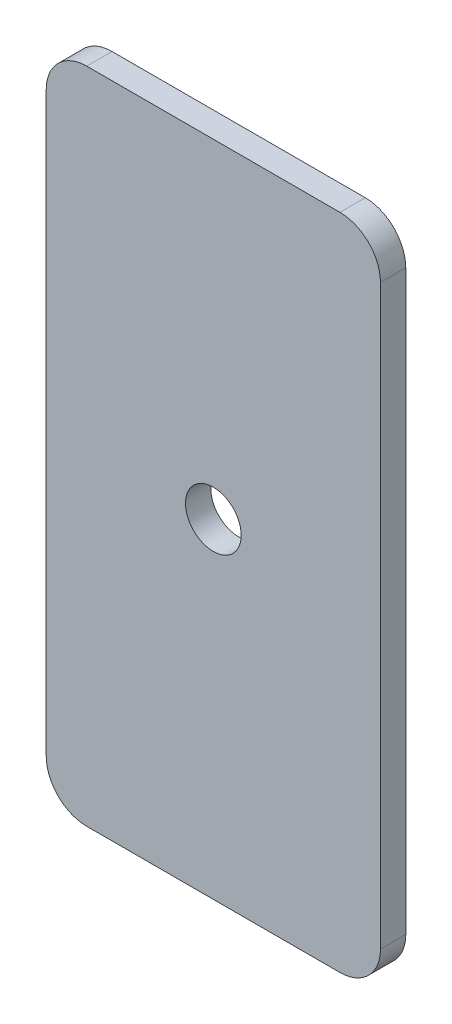
from build123d import *

# Parameters (mm, degrees)
BOSS_EXTRUDE1_DEPTH = 5
SKETCH2_R           = 5.5
CUT_EXTRUDE1_DEPTH  = 5


with BuildPart() as part:
    # Sketch1 → Boss-Extrude1 (new body)
    with BuildSketch(Plane.XY):
        with BuildLine():
            Line((25, 65), (-25, 65))
            ThreePointArc((-25, 65), (-30.656854249, 62.656854249), (-33, 57))
            Line((-33, 57), (-33, -57))
            ThreePointArc((-33, -57), (-30.656854249, -62.656854249), (-25, -65))
            Line((-25, -65), (25, -65))
            ThreePointArc((25, -65), (30.656854249, -62.656854249), (33, -57))
            Line((33, -57), (33, 57))
            ThreePointArc((33, 57), (30.656854249, 62.656854249), (25, 65))
        make_face()
    extrude(amount=BOSS_EXTRUDE1_DEPTH)

    # Sketch2 → Cut-Extrude1 (cut)
    with BuildSketch(Plane.XY.offset(5)):
        Circle(SKETCH2_R)
    extrude(amount=-CUT_EXTRUDE1_DEPTH, mode=Mode.SUBTRACT)


solid = part.part
